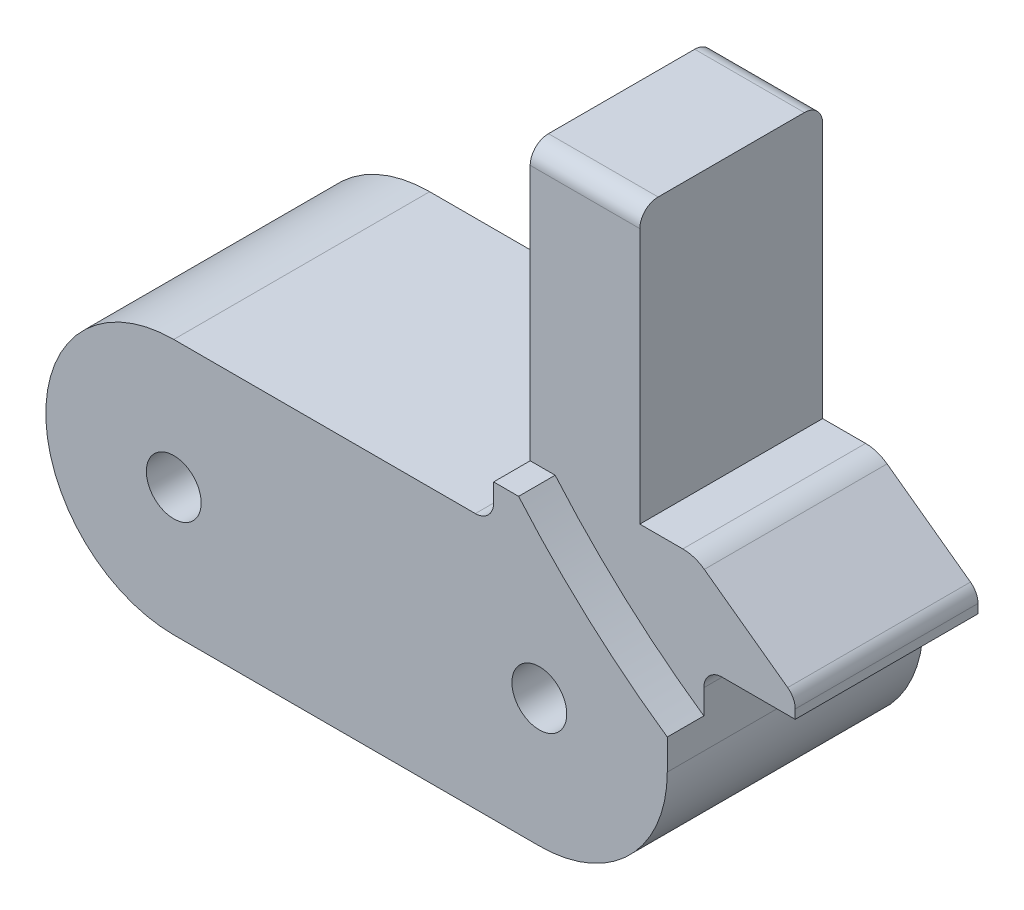
from build123d import *

# Parameters (mm, degrees)
SKETCH_1_R          = 7
SKETCH_1_R_2        = 1.5
EXTRUDE_1_DEPTH     = 14
FILLET_2_R          = 1
FILLET_4_R          = 2
FILLET_5_R          = 1
CUT_EXTRUDE_1_DEPTH = 10
FILLET_6_R          = 1
SKETCH_4_R          = 43
SKETCH_4_W          = 56
SKETCH_4_H          = 56
CUT_EXTRUDE_2_DEPTH = 2


with BuildPart() as part:
    # 草图1 → 凸台-拉伸1 (new body)
    # profile 1 of 3: a face of its own
    with BuildSketch(Plane.XY):
        with BuildLine():
            Line((-2.5, 7), (-20, 7))
            ThreePointArc((-20, 7), (-15.050252532, 4.949747468), (-13, 0))
            ThreePointArc((-13, 0), (-15.050252532, -4.949747468), (-20, -7))
            Line((-20, -7), (0, -7))
            ThreePointArc((0, -7), (-4.949747468, 4.949747468), (7, 0))
            Line((7, 0), (7, 4))
            Line((7, 4), (12, 4))
            Line((12, 4), (12, 5))
            Line((12, 5), (6.5, 9))
            Line((6.5, 9), (3.5, 9))
            Line((3.5, 9), (3.5, 26))
            Line((3.5, 26), (-2.5, 26))
            Line((-2.5, 26), (-2.5, 7))
        make_face()
    # profile 2 of 3: a face of its own
    with BuildSketch(Plane.XY):
        Circle(SKETCH_1_R)
        Circle(SKETCH_1_R_2, mode=Mode.SUBTRACT)
    # profile 3 of 3: a face of its own
    with BuildSketch(Plane.XY):
        with Locations((-20, 0)):
            Circle(SKETCH_1_R)
        with Locations((-20, 0)):
            Circle(SKETCH_1_R_2, mode=Mode.SUBTRACT)
    extrude(amount=EXTRUDE_1_DEPTH)

    # 圆角2
    fillet_2_edges = [part.edges().sort_by_distance(p)[0] for p in [
        (-2.5, 7, 7),
        (7, 4, 7),
    ]]
    fillet(fillet_2_edges, radius=FILLET_2_R)

    # 圆角4
    fillet_4_edges = [part.edges().sort_by_distance(p)[0] for p in [
        (6.5, 9, 7),
    ]]
    fillet(fillet_4_edges, radius=FILLET_4_R)

    # 圆角5
    fillet_5_edges = [part.edges().sort_by_distance(p)[0] for p in [
        (12, 5, 7),
    ]]
    fillet(fillet_5_edges, radius=FILLET_5_R)

    # 草图2 → 切除-拉伸1 (cut)
    with BuildSketch(Plane(origin=(3.5, 0, 0), x_dir=(0, 0, -1), z_dir=(1, 0, 0))):
        Polygon((-12, 9), (-14, 9), (-14, 26), (0, 26), (0, 9), (-2, 9), (-2, 24), (-12, 24), align=None)
    extrude(amount=-CUT_EXTRUDE_1_DEPTH, mode=Mode.SUBTRACT)

    # 圆角6
    fillet_6_edges = [part.edges().sort_by_distance(p)[0] for p in [
        (0.5, 24, 12),
        (0.5, 24, 2),
    ]]
    fillet(fillet_6_edges, radius=FILLET_6_R)

    # 草图4 → 切除-拉伸2 (cut)
    with BuildSketch(Plane.XY.offset(14)):
        with Locations((31.5, 37)):
            Circle(SKETCH_4_R)
        with Locations((31.5, 37)):
            Rectangle(SKETCH_4_W, SKETCH_4_H, mode=Mode.SUBTRACT)
    cut_extrude_2 = extrude(amount=-CUT_EXTRUDE_2_DEPTH, mode=Mode.SUBTRACT)

    # 镜向1: 切除-拉伸2 across plane
    add(cut_extrude_2.mirror(Plane.XY.offset(7)), mode=Mode.SUBTRACT)


solid = part.part
